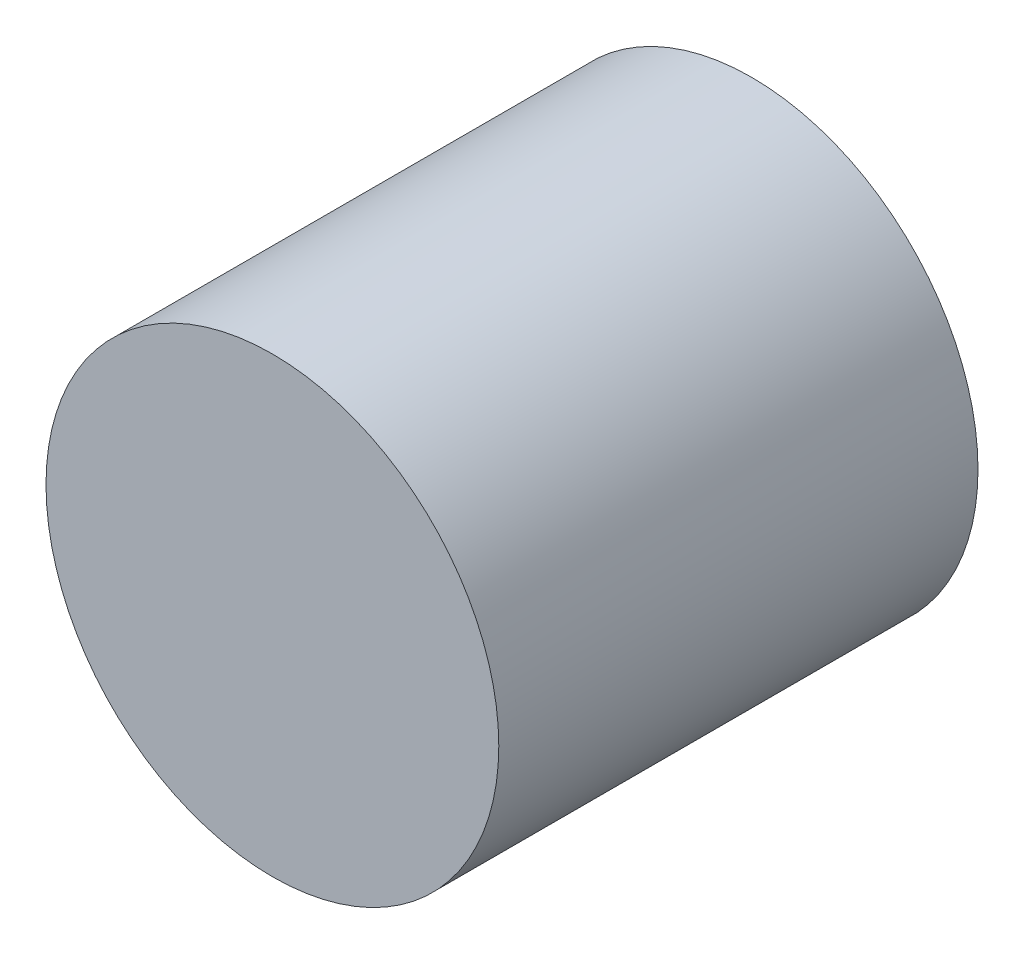
from build123d import *

# Parameters (mm, degrees)
SKETCH1_R           = 3
BOSS_EXTRUDE1_DEPTH = 6.35


with BuildPart() as part:
    # Sketch1 → Boss-Extrude1 (new body)
    with BuildSketch(Plane.XY):
        Circle(SKETCH1_R)
    extrude(amount=BOSS_EXTRUDE1_DEPTH)


solid = part.part
